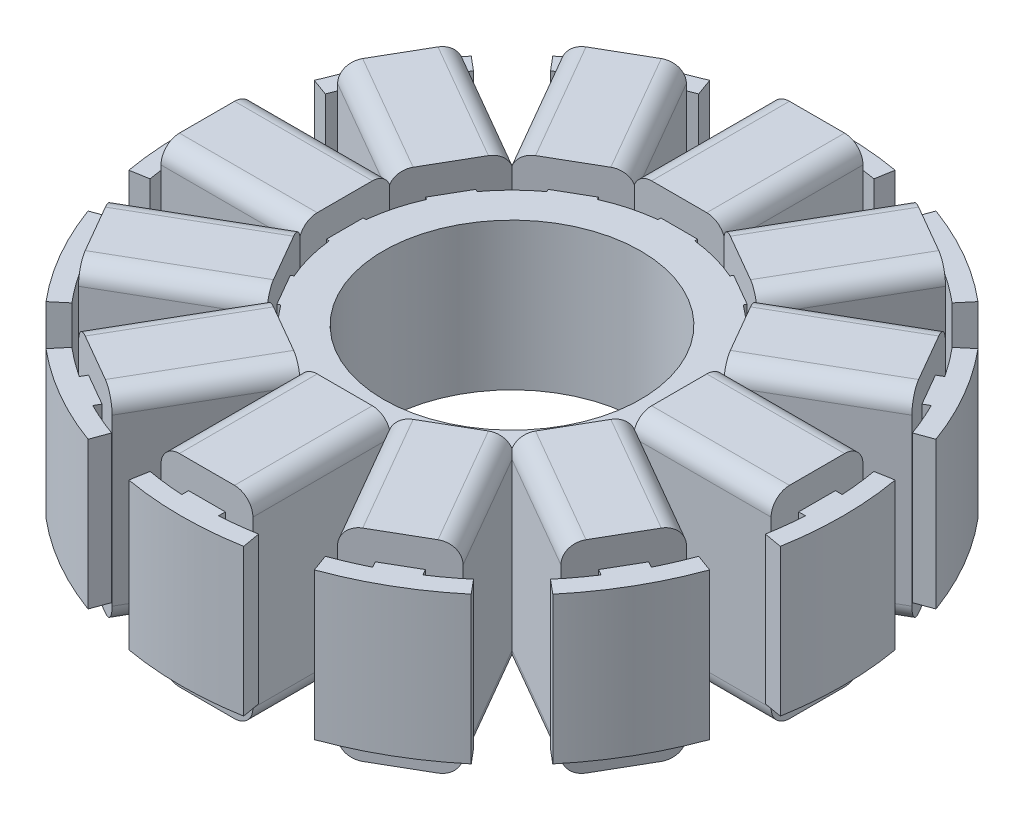
from build123d import *

# Parameters (mm, degrees)
SKETCH1_R           = 9
SKETCH1_R_2         = 7
BOSS_EXTRUDE1_DEPTH = 8
BOSS_EXTRUDE4_DEPTH = 8
BOSS_EXTRUDE5_DEPTH = 7.5
CIRPATTERN2_COUNT   = 12
CIRPATTERN3_COUNT   = 12


with BuildPart() as part:
    # Sketch1 → Boss-Extrude1 (new body)
    with BuildSketch(Plane(origin=(0, 0, 0), x_dir=(1, 0, 0), z_dir=(0, 1, 0))):
        with Locations(Location((0, 0, 0), (0, 0, 270))):
            Circle(SKETCH1_R)
        with Locations(Location((0, 0, 0), (0, 0, 270))):
            Circle(SKETCH1_R_2, mode=Mode.SUBTRACT)
    extrude(amount=BOSS_EXTRUDE1_DEPTH)

    # Sketch1<3> → Boss-Extrude4 (add)
    with BuildSketch(Plane(origin=(0, 0, 0), x_dir=(1, 0, 0), z_dir=(0, 1, 0))):
        with BuildLine():
            Line((-1, 16.970562748), (-1, 8.94427191))
            ThreePointArc((-1, 8.94427191), (0, 9), (1, 8.94427191))
            Line((1, 8.94427191), (1, 16.970562748))
            ThreePointArc((1, 16.970562748), (1.979319197, 16.884380223), (2.95201902, 16.741731801))
            Line((2.95201902, 16.741731801), (3.125667198, 17.726539554))
            ThreePointArc((3.125667198, 17.726539554), (0, 18), (-3.125667198, 17.726539554))
            Line((-3.125667198, 17.726539554), (-2.95201902, 16.741731801))
            ThreePointArc((-2.95201902, 16.741731801), (-1.979319197, 16.884380223), (-1, 16.970562748))
        make_face()
    boss_extrude4 = extrude(amount=BOSS_EXTRUDE4_DEPTH)

    # Sketch2 → Boss-Extrude5 (add)
    with BuildSketch(Plane.XY.offset(-9.1)):
        with BuildLine():
            Line((-2.5, 8.5), (-2.5, -0.5))
            ThreePointArc((-2.5, -0.5), (-2.207106781, -1.207106781), (-1.5, -1.5))
            Line((-1.5, -1.5), (1.5, -1.5))
            ThreePointArc((1.5, -1.5), (2.207106781, -1.207106781), (2.5, -0.5))
            Line((2.5, -0.5), (2.5, 8.5))
            ThreePointArc((2.5, 8.5), (2.207106781, 9.207106781), (1.5, 9.5))
            Line((1.5, 9.5), (-1.5, 9.5))
            ThreePointArc((-1.5, 9.5), (-2.207106781, 9.207106781), (-2.5, 8.5))
        make_face()
    boss_extrude5 = extrude(amount=-BOSS_EXTRUDE5_DEPTH)

    # CirPattern2: Boss-Extrude4 ×12 about axis
    cirpattern2_axis = Axis((0, 0, 0), (0, 1, 0))
    for i in range(1, CIRPATTERN2_COUNT):
        add(boss_extrude4.rotate(cirpattern2_axis, i * 360 / CIRPATTERN2_COUNT))

    # CirPattern3: Boss-Extrude5 ×12 about axis
    cirpattern3_axis = Axis((0, 0, 0), (0, 1, 0))
    for i in range(1, CIRPATTERN3_COUNT):
        add(boss_extrude5.rotate(cirpattern3_axis, i * 360 / CIRPATTERN3_COUNT))


solid = part.part
